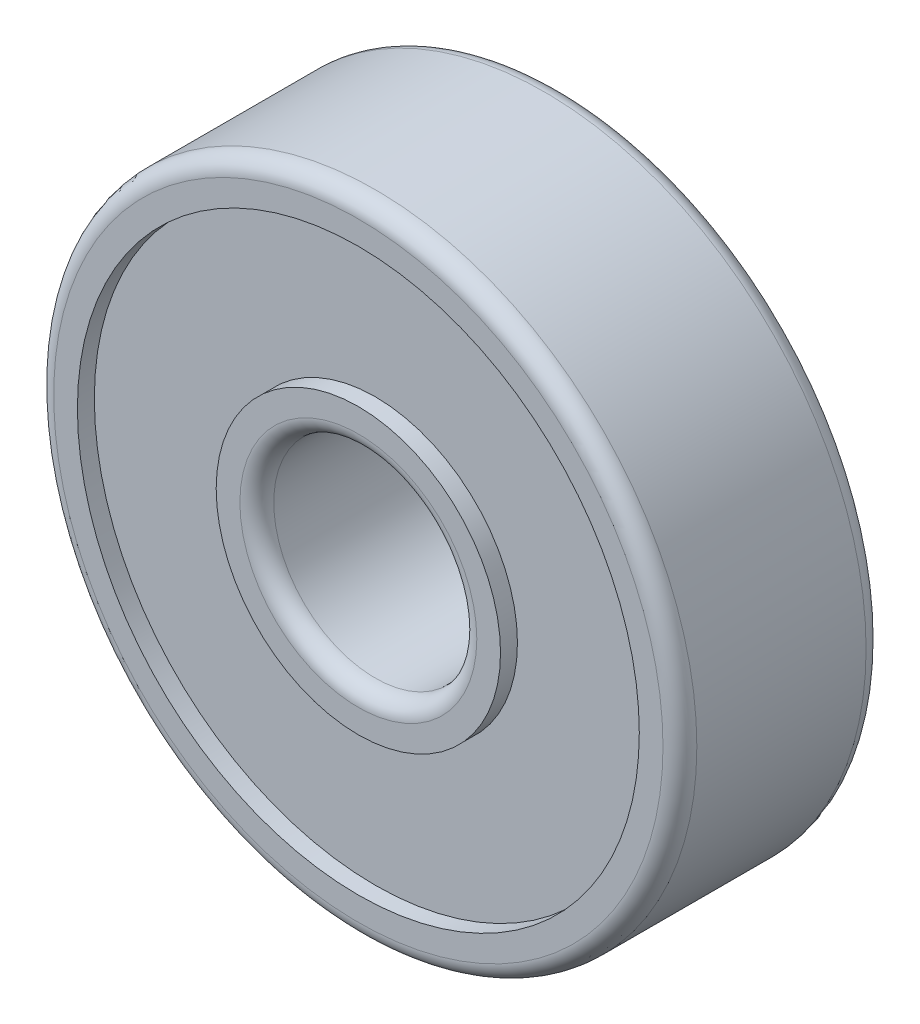
from build123d import *

# Parameters (mm, degrees)
ESBO_O1_R                = 9.5
ESBO_O1_R_2              = 3
RESSALTO_EXTRUS_O1_DEPTH = 6
ESBO_O2_R                = 8.3
ESBO_O2_R_2              = 4.2
CORTE_EXTRUS_O1_DEPTH    = 0.5
CORTE_EXTRUS_O2_START    = -0.5
ESBO_O3_R                = 8.3
ESBO_O3_R_2              = 4.2
CORTE_EXTRUS_O2_DEPTH    = 0.5
FILETE1_R                = 0.5


with BuildPart() as part:
    # Esboço1 → Ressalto-extrusão1 (new body)
    with BuildSketch(Plane.XY):
        Circle(ESBO_O1_R)
        Circle(ESBO_O1_R_2, mode=Mode.SUBTRACT)
    extrude(amount=RESSALTO_EXTRUS_O1_DEPTH)

    # Esboço2 → Corte-extrusão1 (cut)
    with BuildSketch(Plane.XY.offset(6)):
        Circle(ESBO_O2_R)
        Circle(ESBO_O2_R_2, mode=Mode.SUBTRACT)
    extrude(amount=-CORTE_EXTRUS_O1_DEPTH, mode=Mode.SUBTRACT)

    # Esboço3 → Corte-extrusão2 (cut)
    with BuildSketch(Plane(origin=(0, 0, 0), x_dir=(-1, 0, 0), z_dir=(0, 0, -1)).offset(CORTE_EXTRUS_O2_START)):
        with Locations(Location((0, 0, 0), (0, 0, 180))):
            Circle(ESBO_O3_R)
        with Locations(Location((0, 0, 0), (0, 0, 180))):
            Circle(ESBO_O3_R_2, mode=Mode.SUBTRACT)
    extrude(amount=CORTE_EXTRUS_O2_DEPTH, mode=Mode.SUBTRACT)

    # Filete1
    filete1_edges = [part.edges().sort_by_distance(p)[0] for p in [
        (-9.5, 0, 0),
        (-9.5, 0, 6),
        (-3, 0, 0),
        (-3, 0, 6),
    ]]
    fillet(filete1_edges, radius=FILETE1_R)


solid = part.part
